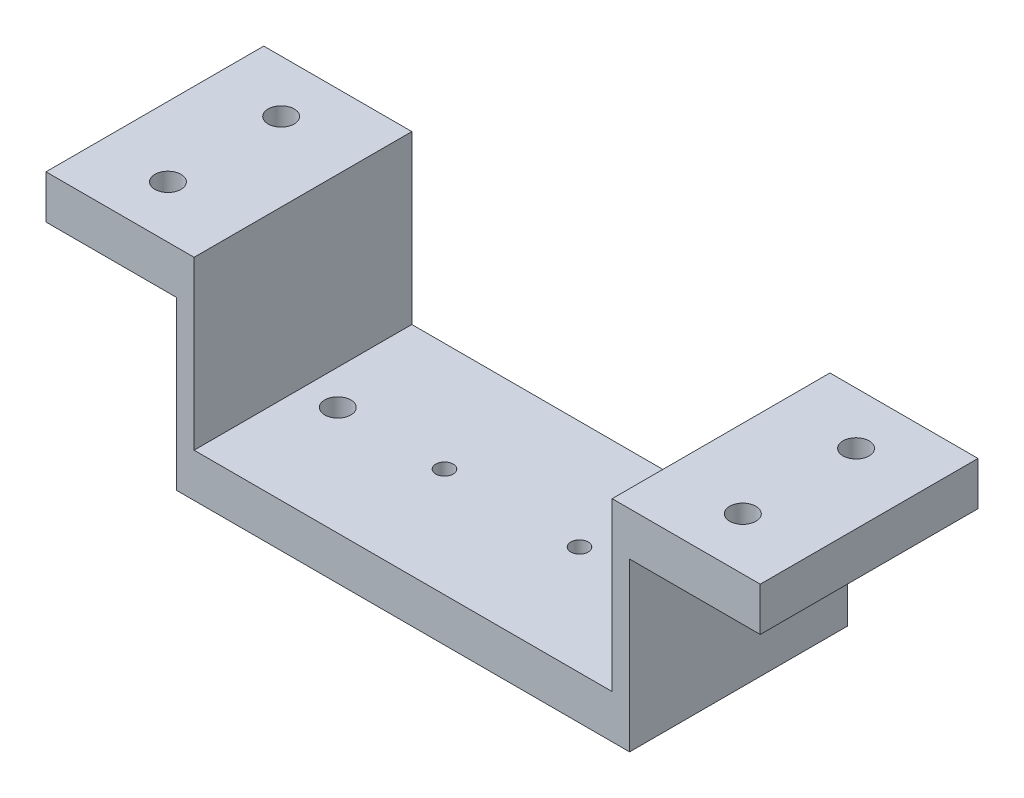
from build123d import *

# Parameters (mm, degrees)
SKETCH1_W               = 52
SKETCH1_H               = 25
BOSS_EXTRUDE1_DEPTH     = 24.18
SKETCH4_W               = 48
SKETCH4_H               = 21.11598097
CUT_EXTRUDE1_DEPTH      = 25
SKETCH6_R               = 1
SKETCH6_R_2             = 1.5
CUT_EXTRUDE5_DEPTH      = 24.18
SKETCH8_W               = 25
SKETCH8_H               = 5
BOSS_EXTRUDE2_DEPTH     = 15
SKETCH9_R               = 1.5
CUT_EXTRUDE7_DEPTH      = 5
MIRROR4_COPY_1_SKETCH_R = 1.5
MIRROR4_COPY_1_DEPTH    = 5


with BuildPart() as part:
    # Sketch1 → Boss-Extrude1 (new body)
    with BuildSketch(Plane(origin=(0, 0, 0), x_dir=(1, 0, 0), z_dir=(0, 1, 0))):
        Rectangle(SKETCH1_W, SKETCH1_H)
    extrude(amount=BOSS_EXTRUDE1_DEPTH)

    # Sketch4 → Cut-Extrude1 (cut)
    with BuildSketch(Plane.XY.offset(12.5)):
        with Locations((0, 15.557990485)):
            Rectangle(SKETCH4_W, SKETCH4_H)
    extrude(amount=-CUT_EXTRUDE1_DEPTH, mode=Mode.SUBTRACT)

    # Sketch6 → Cut-Extrude5 (cut)
    with BuildSketch(Plane.XZ):
        with Locations(Location((-7.75, 0, 0), (0, 0, 270))):
            Circle(SKETCH6_R)
        with Locations(Location((-20, 0, 0), (0, 0, 270))):
            Circle(SKETCH6_R_2)
        with Locations(Location((7.75, 0, 0), (0, 0, 270))):
            Circle(SKETCH6_R)
        with Locations(Location((20, 0, 0), (0, 0, 270))):
            Circle(SKETCH6_R_2)
    extrude(amount=-CUT_EXTRUDE5_DEPTH, mode=Mode.SUBTRACT)

    # Sketch8 → Boss-Extrude2 (add)
    with BuildSketch(Plane(origin=(26, 0, 0), x_dir=(0, 0, -1), z_dir=(1, 0, 0))):
        with Locations((0, 21.68)):
            Rectangle(SKETCH8_W, SKETCH8_H)
    boss_extrude2 = extrude(amount=BOSS_EXTRUDE2_DEPTH)

    # Sketch9 → Cut-Extrude7 (cut)
    with BuildSketch(Plane(origin=(0, 24.18, 0), x_dir=(1, 0, 0), z_dir=(0, 1, 0))):
        with Locations(Location((33, 6.5, 0), (0, 0, 270))):
            Circle(SKETCH9_R)
    cut_extrude7 = extrude(amount=-CUT_EXTRUDE7_DEPTH, mode=Mode.SUBTRACT)

    # Mirror3: Cut-Extrude7 across plane
    add(cut_extrude7.mirror(Plane.XY), mode=Mode.SUBTRACT)

    # Mirror4: Boss-Extrude2, Cut-Extrude7 across plane
    add(boss_extrude2.mirror(Plane(origin=(0, 0, 0), x_dir=(0, 0, 1), z_dir=(1, 0, 0))))
    add(cut_extrude7.mirror(Plane(origin=(0, 0, 0), x_dir=(0, 0, 1), z_dir=(1, 0, 0))), mode=Mode.SUBTRACT)

    # Mirror4 copy 1 sketch → Mirror4 copy 1 (cut)
    with BuildSketch(Plane(origin=(0, 24.18, 0), x_dir=(-1, 0, 0), z_dir=(0, 1, 0))):
        with Locations(Location((33, 6.5, 0), (0, 0, 270))):
            Circle(MIRROR4_COPY_1_SKETCH_R)
    extrude(amount=-MIRROR4_COPY_1_DEPTH, mode=Mode.SUBTRACT)


solid = part.part
